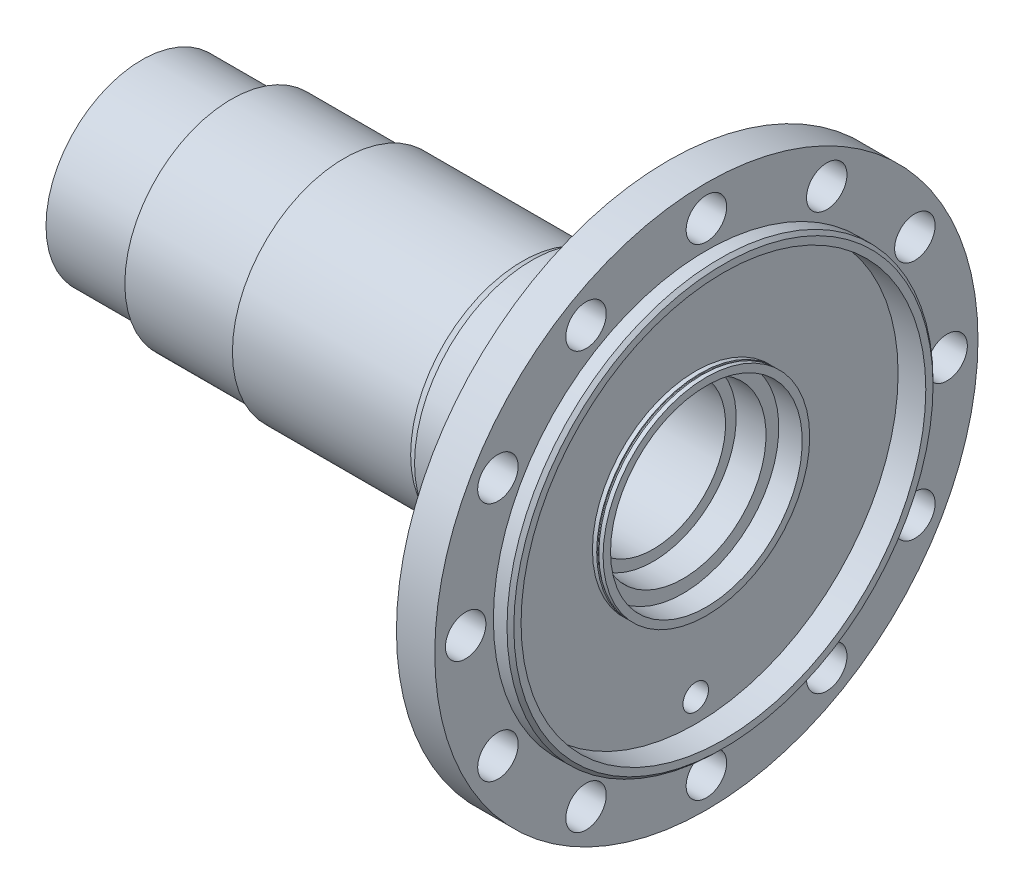
from build123d import *

# Parameters (mm, degrees)
SKETCH_3_W           = 2
SKETCH_3_H           = 46.5
SKETCH_5_W           = 2
SKETCH_5_H           = 46.5
SKETCH_6_R           = 9.5
CUT_EXTRUDE_1_DEPTH  = 328.171973127
SKETCH_7_R           = 9.5
CUT_EXTRUDE_2_DEPTH  = 328.171973127
SKETCH_8_R           = 9.5
CUT_EXTRUDE_3_DEPTH  = 328.171973127
SKETCH_9_R           = 9.5
CUT_EXTRUDE_4_DEPTH  = 328.171973127
SKETCH_10_R          = 9.5
CUT_EXTRUDE_5_DEPTH  = 328.171973127
SKETCH_11_R          = 9.5
CUT_EXTRUDE_6_DEPTH  = 328.171973127
SKETCH_12_R          = 9.5
CUT_EXTRUDE_7_DEPTH  = 328.171973127
SKETCH_13_R          = 9.5
CUT_EXTRUDE_8_DEPTH  = 328.171973127
SKETCH_14_R          = 9.5
CUT_EXTRUDE_9_DEPTH  = 328.171973127
SKETCH_15_R          = 9.5
CUT_EXTRUDE_10_DEPTH = 328.171973127
SKETCH_16_R          = 9.5
CUT_EXTRUDE_11_DEPTH = 328.171973127
SKETCH_17_R          = 9.5
CUT_EXTRUDE_12_DEPTH = 328.171973127
SKETCH_18_R          = 6
CUT_EXTRUDE_13_DEPTH = 328.171973127


with BuildPart() as part:
    # Эскиз1 → Повернуть1 (revolve)
    with BuildSketch(Plane.XY, mode=Mode.PRIVATE) as revolve_1_sk:
        with BuildLine():
            Line((0, 0), (273, 0))
            Line((273, 0), (273, 98.4))
            Line((273, 98.4), (271.4, 100))
            Line((271.4, 100), (265, 100))
            Line((265, 100), (265, 127.5))
            Line((265, 127.5), (247, 127.5))
            Line((247, 127.5), (247, 100))
            Line((247, 100), (239, 100))
            Line((239, 100), (239, 62.5))
            Line((239, 62.5), (218, 62.5))
            Line((218, 62.5), (215, 60.767949192))
            Line((215, 60.767949192), (215, 57))
            ThreePointArc((215, 57), (214.414213562, 55.585786438), (213, 55))
            Line((213, 55), (183, 55))
            Line((183, 55), (178.669872981, 52.5))
            Line((178.669872981, 52.5), (95, 52.5))
            Line((95, 52.5), (95, 50))
            Line((95, 50), (42, 50))
            Line((42, 50), (42, 45))
            Line((42, 45), (0, 45))
            Line((0, 45), (0, 0))
        make_face()
    revolve(revolve_1_sk.sketch.rotate(Axis((0, 0, 0), (1, 0, 0)), 90), axis=Axis((0, 0, 0), (1, 0, 0)))

    # Эскиз2 → Вырез-Повернуть1 (revolve, cut)
    with BuildSketch(Plane.XY, mode=Mode.PRIVATE) as cut_revolve_1_sk:
        Polygon((0, 0), (273, 0), (273, 95), (265, 95), (265, 45), (254, 45), (254, 39), (240, 39), (240, 34), (203.5, 34), (203.5, 31), (0, 31), align=None)
    revolve(cut_revolve_1_sk.sketch.rotate(Axis((0, 0, 0), (1, 0, 0)), 90), axis=Axis((0, 0, 0), (1, 0, 0)), mode=Mode.SUBTRACT)

    # Эскиз3 → Rear_recess_left (revolve, cut)
    with BuildSketch(Plane.XY, mode=Mode.PRIVATE) as rear_recess_left_sk:
        with Locations((261, 71.75)):
            Rectangle(SKETCH_3_W, SKETCH_3_H)
    revolve(rear_recess_left_sk.sketch.rotate(Axis((0, 0, 0), (1, 0, 0)), 90), axis=Axis((0, 0, 0), (1, 0, 0)), mode=Mode.SUBTRACT)

    # Эскиз4 → Collar_groove_nominal (revolve, cut)
    with BuildSketch(Plane.XY, mode=Mode.PRIVATE) as collar_groove_nominal_sk:
        with BuildLine():
            Line((263, 48), (263, 95))
            Line((263, 95), (262, 95))
            Line((262, 95), (262, 48))
            ThreePointArc((262, 48), (262.146446609, 47.646446609), (262.5, 47.5))
            ThreePointArc((262.5, 47.5), (262.853553391, 47.646446609), (263, 48))
        make_face()
    revolve(collar_groove_nominal_sk.sketch.rotate(Axis((0, 0, 0), (1, 0, 0)), 90), axis=Axis((0, 0, 0), (1, 0, 0)), mode=Mode.SUBTRACT)

    # Эскиз5 → Rear_recess_lip (revolve, cut)
    with BuildSketch(Plane.XY, mode=Mode.PRIVATE) as rear_recess_lip_sk:
        with Locations((264, 71.75)):
            Rectangle(SKETCH_5_W, SKETCH_5_H)
    revolve(rear_recess_lip_sk.sketch.rotate(Axis((0, 0, 0), (1, 0, 0)), 90), axis=Axis((0, 0, 0), (1, 0, 0)), mode=Mode.SUBTRACT)

    # Эскиз6 → Вырез-Вытянуть1 (cut, through all)
    with BuildSketch(Plane(origin=(0, 0, 0), x_dir=(0, 0, -1), z_dir=(1, 0, 0))):
        with Locations(Location((0, 113, 0), (0, 0, 180))):
            Circle(SKETCH_6_R)
    extrude(amount=CUT_EXTRUDE_1_DEPTH, mode=Mode.SUBTRACT)

    # Эскиз7 → Вырез-Вытянуть2 (cut, through all)
    with BuildSketch(Plane(origin=(0, 0, 0), x_dir=(0, 0, -1), z_dir=(1, 0, 0))):
        with Locations(Location((-56.5, 97.860870628, 0), (0, 0, 180))):
            Circle(SKETCH_7_R)
    extrude(amount=CUT_EXTRUDE_2_DEPTH, mode=Mode.SUBTRACT)

    # Эскиз8 → Вырез-Вытянуть3 (cut, through all)
    with BuildSketch(Plane(origin=(0, 0, 0), x_dir=(0, 0, -1), z_dir=(1, 0, 0))):
        with Locations(Location((-97.860870628, 56.5, 0), (0, 0, 180))):
            Circle(SKETCH_8_R)
    extrude(amount=CUT_EXTRUDE_3_DEPTH, mode=Mode.SUBTRACT)

    # Эскиз9 → Вырез-Вытянуть4 (cut, through all)
    with BuildSketch(Plane(origin=(0, 0, 0), x_dir=(0, 0, -1), z_dir=(1, 0, 0))):
        with Locations(Location((-113, 0, 0), (0, 0, 180))):
            Circle(SKETCH_9_R)
    extrude(amount=CUT_EXTRUDE_4_DEPTH, mode=Mode.SUBTRACT)

    # Эскиз10 → Вырез-Вытянуть5 (cut, through all)
    with BuildSketch(Plane(origin=(0, 0, 0), x_dir=(0, 0, -1), z_dir=(1, 0, 0))):
        with Locations(Location((-97.860870628, -56.5, 0), (0, 0, 180))):
            Circle(SKETCH_10_R)
    extrude(amount=CUT_EXTRUDE_5_DEPTH, mode=Mode.SUBTRACT)

    # Эскиз11 → Вырез-Вытянуть6 (cut, through all)
    with BuildSketch(Plane(origin=(0, 0, 0), x_dir=(0, 0, -1), z_dir=(1, 0, 0))):
        with Locations(Location((-56.5, -97.860870628, 0), (0, 0, 180))):
            Circle(SKETCH_11_R)
    extrude(amount=CUT_EXTRUDE_6_DEPTH, mode=Mode.SUBTRACT)

    # Эскиз12 → Вырез-Вытянуть7 (cut, through all)
    with BuildSketch(Plane(origin=(0, 0, 0), x_dir=(0, 0, -1), z_dir=(1, 0, 0))):
        with Locations(Location((0, -113, 0), (0, 0, 180))):
            Circle(SKETCH_12_R)
    extrude(amount=CUT_EXTRUDE_7_DEPTH, mode=Mode.SUBTRACT)

    # Эскиз13 → Вырез-Вытянуть8 (cut, through all)
    with BuildSketch(Plane(origin=(0, 0, 0), x_dir=(0, 0, -1), z_dir=(1, 0, 0))):
        with Locations(Location((56.5, -97.860870628, 0), (0, 0, 180))):
            Circle(SKETCH_13_R)
    extrude(amount=CUT_EXTRUDE_8_DEPTH, mode=Mode.SUBTRACT)

    # Эскиз14 → Вырез-Вытянуть9 (cut, through all)
    with BuildSketch(Plane(origin=(0, 0, 0), x_dir=(0, 0, -1), z_dir=(1, 0, 0))):
        with Locations(Location((97.860870628, -56.5, 0), (0, 0, 180))):
            Circle(SKETCH_14_R)
    extrude(amount=CUT_EXTRUDE_9_DEPTH, mode=Mode.SUBTRACT)

    # Эскиз15 → Вырез-Вытянуть10 (cut, through all)
    with BuildSketch(Plane(origin=(0, 0, 0), x_dir=(0, 0, -1), z_dir=(1, 0, 0))):
        with Locations(Location((113, 0, 0), (0, 0, 180))):
            Circle(SKETCH_15_R)
    extrude(amount=CUT_EXTRUDE_10_DEPTH, mode=Mode.SUBTRACT)

    # Эскиз16 → Вырез-Вытянуть11 (cut, through all)
    with BuildSketch(Plane(origin=(0, 0, 0), x_dir=(0, 0, -1), z_dir=(1, 0, 0))):
        with Locations(Location((97.860870628, 56.5, 0), (0, 0, 180))):
            Circle(SKETCH_16_R)
    extrude(amount=CUT_EXTRUDE_11_DEPTH, mode=Mode.SUBTRACT)

    # Эскиз17 → Вырез-Вытянуть12 (cut, through all)
    with BuildSketch(Plane(origin=(0, 0, 0), x_dir=(0, 0, -1), z_dir=(1, 0, 0))):
        with Locations(Location((56.5, 97.860870628, 0), (0, 0, 180))):
            Circle(SKETCH_17_R)
    extrude(amount=CUT_EXTRUDE_12_DEPTH, mode=Mode.SUBTRACT)

    # Эскиз18 → Вырез-Вытянуть13 (cut, through all)
    with BuildSketch(Plane(origin=(0, 0, 0), x_dir=(0, 0, -1), z_dir=(1, 0, 0))):
        with Locations((0, -84)):
            Circle(SKETCH_18_R)
    extrude(amount=CUT_EXTRUDE_13_DEPTH, mode=Mode.SUBTRACT)


solid = part.part
